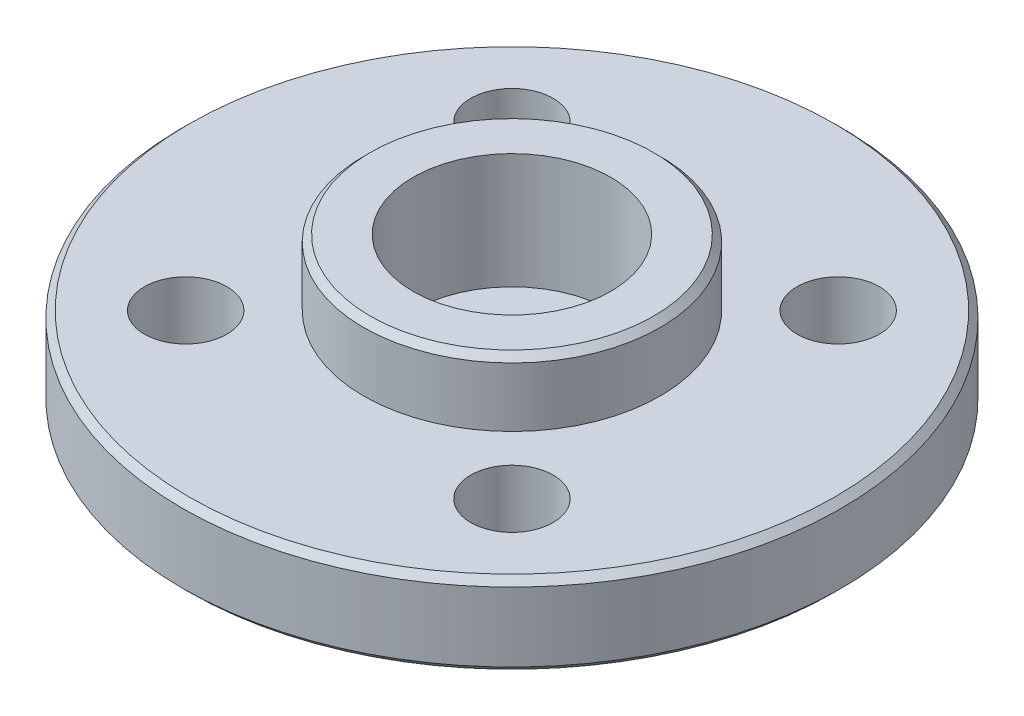
from build123d import *

# Parameters (mm, degrees)
SKETCH_1_R          = 10
EXTRUDE_1_DEPTH     = 1.25
SKETCH_2_R          = 1.25
CUT_EXTRUDE_1_DEPTH = 15.361406616
SKETCH_3_R          = 4.5
EXTRUDE_2_DEPTH     = 2
SKETCH_4_R          = 3
CUT_EXTRUDE_2_DEPTH = 3.5
SKETCH_5_R          = 1.5
CUT_EXTRUDE_3_DEPTH = 1
CHAMFER_1_SIZE      = 0.2
CHAMFER_2_SIZE      = 0.2
CHAMFER_3_SIZE      = 0.2


with BuildPart() as part:
    # 草图1 → 凸台-拉伸1 (new, symmetric)
    with BuildSketch(Plane(origin=(0, 0, 0), x_dir=(1, 0, 0), z_dir=(0, 1, 0))):
        with Locations(Location((0, 0, 0), (0, 0, 270))):
            Circle(SKETCH_1_R)
    extrude(amount=EXTRUDE_1_DEPTH, both=True)

    # 草图2 → 切除-拉伸1 (cut, through all)
    with BuildSketch(Plane(origin=(0, 1.25, 0), x_dir=(1, 0, 0), z_dir=(0, 1, 0))):
        with Locations(Location((4.949747468, 4.949747468, 0), (0, 0, 270))):
            Circle(SKETCH_2_R)
        with Locations(Location((4.949747468, -4.949747468, 0), (0, 0, 270))):
            Circle(SKETCH_2_R)
        with Locations(Location((-4.949747468, 4.949747468, 0), (0, 0, 270))):
            Circle(SKETCH_2_R)
        with Locations(Location((-4.949747468, -4.949747468, 0), (0, 0, 270))):
            Circle(SKETCH_2_R)
    extrude(amount=-CUT_EXTRUDE_1_DEPTH, mode=Mode.SUBTRACT)

    # 草图3 → 凸台-拉伸2 (add)
    with BuildSketch(Plane(origin=(0, 1.25, 0), x_dir=(1, 0, 0), z_dir=(0, 1, 0))):
        with Locations(Location((0, 0, 0), (0, 0, 270))):
            Circle(SKETCH_3_R)
    extrude(amount=EXTRUDE_2_DEPTH)

    # 草图4 → 切除-拉伸2 (cut)
    with BuildSketch(Plane(origin=(0, 3.25, 0), x_dir=(1, 0, 0), z_dir=(0, 1, 0))):
        with Locations(Location((0, 0, 0), (0, 0, 270))):
            Circle(SKETCH_4_R)
    extrude(amount=-CUT_EXTRUDE_2_DEPTH, mode=Mode.SUBTRACT)

    # 草图5 → 切除-拉伸3 (cut)
    with BuildSketch(Plane.XZ.offset(1.25)):
        with Locations(Location((0, 0, 0), (0, 0, 270))):
            Circle(SKETCH_5_R)
    extrude(amount=-CUT_EXTRUDE_3_DEPTH, mode=Mode.SUBTRACT)

    # 倒角1
    chamfer_1_edges = [part.edges().sort_by_distance(p)[0] for p in [
        (0, 3.25, -4.5),
    ]]
    chamfer(chamfer_1_edges, length=CHAMFER_1_SIZE)

    # 倒角2
    chamfer_2_edges = [part.edges().sort_by_distance(p)[0] for p in [
        (0, -1.25, -10),
        (0, 1.25, -10),
    ]]
    chamfer(chamfer_2_edges, length=CHAMFER_2_SIZE)

    # 倒角3
    chamfer_3_edges = [part.edges().sort_by_distance(p)[0] for p in [
        (0, -1.25, 1.5),
    ]]
    chamfer(chamfer_3_edges, length=CHAMFER_3_SIZE)


solid = part.part
